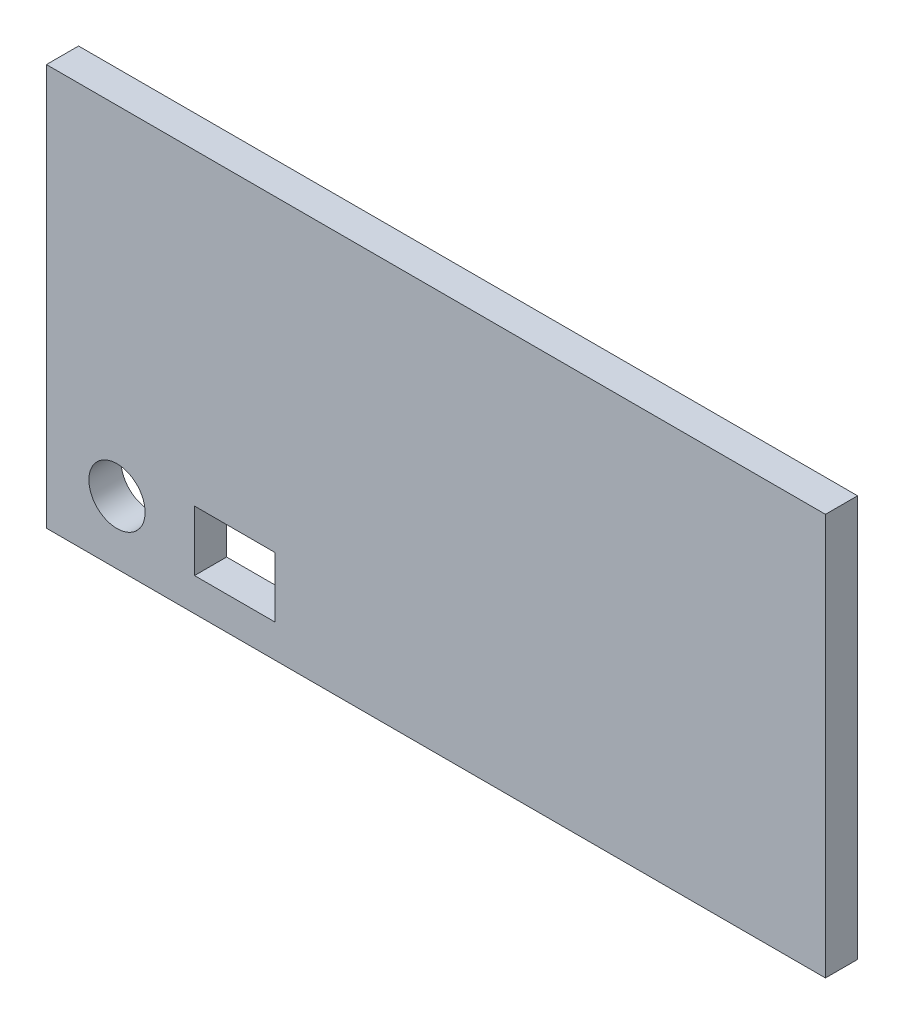
from build123d import *

# Parameters (mm, degrees)
SKETCH_1_W      = 194
SKETCH_1_H      = 100
SKETCH_1_R      = 7
SKETCH_1_W_2    = 20
SKETCH_1_H_2    = 15
EXTRUDE_1_DEPTH = 8


with BuildPart() as part:
    # 草图1 → 凸台-拉伸1 (new body)
    with BuildSketch(Plane.XY):
        with Locations((-7.714285714, 8.75)):
            Rectangle(SKETCH_1_W, SKETCH_1_H)
        with Locations((-87.142857143, -25.535714286)):
            Circle(SKETCH_1_R, mode=Mode.SUBTRACT)
        with Locations((-57.839372956, -25.524240771)):
            Rectangle(SKETCH_1_W_2, SKETCH_1_H_2, mode=Mode.SUBTRACT)
    extrude(amount=EXTRUDE_1_DEPTH)


solid = part.part
